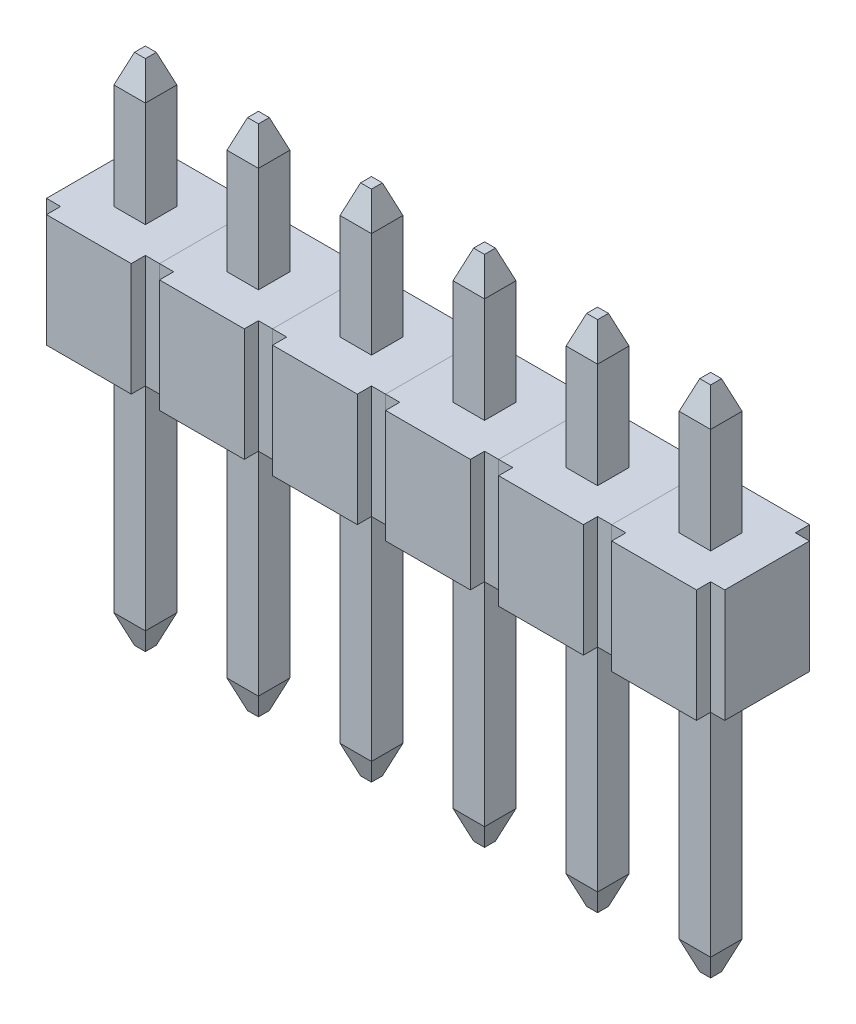
from build123d import *
from OCP.BRepFilletAPI import BRepFilletAPI_MakeChamfer

# Parameters (mm, degrees)
BOSS_EXTRUDE1_DEPTH = 1.27
BOSS_EXTRUDE2_START = -7.27
SKETCH2_W           = 0.707106782
SKETCH2_H           = 0.707106782
BOSS_EXTRUDE2_DEPTH = 11.54
CHAMFER1_SIZE       = 0.635
CHAMFER1_SIZE2      = 0.231121099
LPATTERN1_COUNT     = 6
LPATTERN1_PITCH     = 2.54


with BuildPart() as part:
    # Sketch1 → Boss-Extrude1 (new, symmetric)
    with BuildSketch(Plane(origin=(0, 0, 0), x_dir=(1, 0, 0), z_dir=(0, 1, 0))):
        Polygon((-0.9525, -1.27), (0.9525, -1.27), (0.9525, -0.9525), (1.27, -0.9525), (1.27, 0.9525), (0.9525, 0.9525), (0.9525, 1.27), (-0.9525, 1.27), (-0.9525, 0.9525), (-1.27, 0.9525), (-1.27, -0.9525), (-0.9525, -0.9525), align=None)
    extrude(amount=BOSS_EXTRUDE1_DEPTH, both=True)


with BuildPart() as body_2:
    # Sketch2 → Boss-Extrude2 (new body)
    with BuildSketch(Plane(origin=(0, 0, 0), x_dir=(1, 0, 0), z_dir=(0, 1, 0)).offset(BOSS_EXTRUDE2_START)):
        Rectangle(SKETCH2_W, SKETCH2_H)
    extrude(amount=BOSS_EXTRUDE2_DEPTH)

    # Chamfer1: one chamfer whose edges measure the first distance from different faces: ONE call of the kernel's chamfer builder (chamfer() names one face for all edges)
    chamfer1_edges_1 = [body_2.edges().sort_by_distance(p)[0] for p in [
        (0, -7.27, -0.353553391),
        (0, 4.27, -0.353553391),
    ]]
    chamfer1_side_1 = [body_2.faces().sort_by_distance(p)[0] for p in [
        (0, -1.5, -0.353553391),
    ]]
    chamfer1_edges_2 = [body_2.edges().sort_by_distance(p)[0] for p in [
        (0.353553391, -7.27, 0),
        (0.353553391, 4.27, 0),
    ]]
    chamfer1_side_2 = [body_2.faces().sort_by_distance(p)[0] for p in [
        (0.353553391, -1.5, 0),
    ]]
    chamfer1_edges_3 = [body_2.edges().sort_by_distance(p)[0] for p in [
        (0, -7.27, 0.353553391),
        (0, 4.27, 0.353553391),
    ]]
    chamfer1_side_3 = [body_2.faces().sort_by_distance(p)[0] for p in [
        (0, -1.5, 0.353553391),
    ]]
    chamfer1_edges_4 = [body_2.edges().sort_by_distance(p)[0] for p in [
        (-0.353553391, 4.27, 0),
        (-0.353553391, -7.27, 0),
    ]]
    chamfer1_side_4 = [body_2.faces().sort_by_distance(p)[0] for p in [
        (-0.353553391, -1.5, 0),
    ]]
    chamfer1 = BRepFilletAPI_MakeChamfer(body_2.part.solid().wrapped)
    for e in chamfer1_edges_1:
        chamfer1.Add(CHAMFER1_SIZE, CHAMFER1_SIZE2, e.wrapped, chamfer1_side_1[0].wrapped)  # the first distance lies on this face
    for e in chamfer1_edges_2:
        chamfer1.Add(CHAMFER1_SIZE, CHAMFER1_SIZE2, e.wrapped, chamfer1_side_2[0].wrapped)  # the first distance lies on this face
    for e in chamfer1_edges_3:
        chamfer1.Add(CHAMFER1_SIZE, CHAMFER1_SIZE2, e.wrapped, chamfer1_side_3[0].wrapped)  # the first distance lies on this face
    for e in chamfer1_edges_4:
        chamfer1.Add(CHAMFER1_SIZE, CHAMFER1_SIZE2, e.wrapped, chamfer1_side_4[0].wrapped)  # the first distance lies on this face
    add(Compound.cast(chamfer1.Shape()), mode=Mode.REPLACE)


with BuildPart() as lpattern1_1:
    # LPattern1: pattern copy
    add(part.part.moved(Location(Vector(1, 0, 0) * (1 * LPATTERN1_PITCH))))


with BuildPart() as lpattern1_2:
    # LPattern1: pattern copy
    add(part.part.moved(Location(Vector(1, 0, 0) * (2 * LPATTERN1_PITCH))))


with BuildPart() as lpattern1_3:
    # LPattern1: pattern copy
    add(part.part.moved(Location(Vector(1, 0, 0) * (3 * LPATTERN1_PITCH))))


with BuildPart() as lpattern1_4:
    # LPattern1: pattern copy
    add(part.part.moved(Location(Vector(1, 0, 0) * (4 * LPATTERN1_PITCH))))


with BuildPart() as lpattern1_5:
    # LPattern1: pattern copy
    add(part.part.moved(Location(Vector(1, 0, 0) * (5 * LPATTERN1_PITCH))))


with BuildPart() as lpattern1_6:
    # LPattern1: pattern copy
    add(body_2.part.moved(Location(Vector(1, 0, 0) * (1 * LPATTERN1_PITCH))))


with BuildPart() as lpattern1_7:
    # LPattern1: pattern copy
    add(body_2.part.moved(Location(Vector(1, 0, 0) * (2 * LPATTERN1_PITCH))))


with BuildPart() as lpattern1_8:
    # LPattern1: pattern copy
    add(body_2.part.moved(Location(Vector(1, 0, 0) * (3 * LPATTERN1_PITCH))))


with BuildPart() as lpattern1_9:
    # LPattern1: pattern copy
    add(body_2.part.moved(Location(Vector(1, 0, 0) * (4 * LPATTERN1_PITCH))))


with BuildPart() as lpattern1_10:
    # LPattern1: pattern copy
    add(body_2.part.moved(Location(Vector(1, 0, 0) * (5 * LPATTERN1_PITCH))))


solid = Compound([part.part, body_2.part, lpattern1_1.part, lpattern1_2.part, lpattern1_3.part, lpattern1_4.part, lpattern1_5.part, lpattern1_6.part, lpattern1_7.part, lpattern1_8.part, lpattern1_9.part, lpattern1_10.part])
